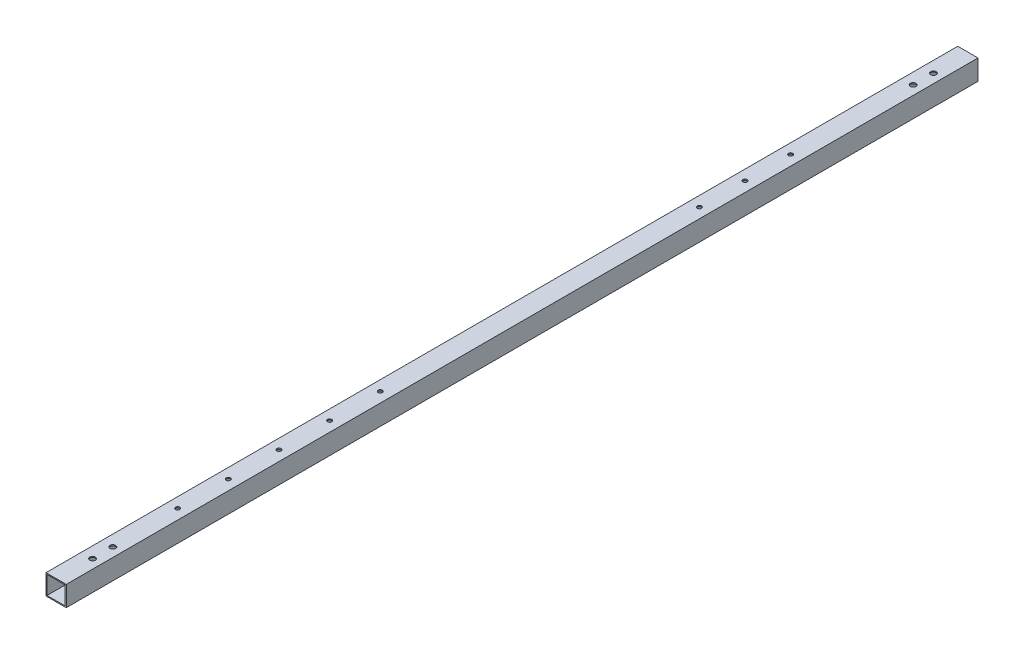
from build123d import *

# Parameters (mm, degrees)
SKETCH_1_W          = 20
SKETCH_1_H          = 20
SKETCH_1_W_2        = 18
SKETCH_1_H_2        = 18
EXTRUDE_1_DEPTH     = 900
SKETCH_2_R          = 2.75
CUT_EXTRUDE_1_DEPTH = 37
SKETCH_3_R          = 2.1
CUT_EXTRUDE_2_DEPTH = 37
SKETCH_4_R          = 2.1
CUT_EXTRUDE_3_DEPTH = 37


with BuildPart() as part:
    # 草图1 → 拉伸-薄壁1 (new body)
    with BuildSketch(Plane.XY):
        with Locations((10, -10)):
            Rectangle(SKETCH_1_W, SKETCH_1_H)
        with Locations((10, -10)):
            Rectangle(SKETCH_1_W_2, SKETCH_1_H_2, mode=Mode.SUBTRACT)
    extrude(amount=EXTRUDE_1_DEPTH)

    # 草图2 → 切除-拉伸1 (cut)
    with BuildSketch(Plane(origin=(0, 0, 0), x_dir=(1, 0, 0), z_dir=(0, 1, 0))):
        with Locations(Location((11, -35, 0), (0, 0, 270))):
            Circle(SKETCH_2_R)
        with Locations(Location((11, -55, 0), (0, 0, 270))):
            Circle(SKETCH_2_R)
        with Locations(Location((11, -845, 0), (0, 0, 90))):
            Circle(SKETCH_2_R)
        with Locations(Location((11, -865, 0), (0, 0, 90))):
            Circle(SKETCH_2_R)
    extrude(amount=-CUT_EXTRUDE_1_DEPTH, mode=Mode.SUBTRACT)

    # 草图3 → 切除-拉伸2 (cut)
    with BuildSketch(Plane(origin=(0, 0, 0), x_dir=(1, 0, 0), z_dir=(0, 1, 0))):
        with Locations(Location((10, -175, 0), (0, 0, 270))):
            Circle(SKETCH_3_R)
        with Locations(Location((10, -220, 0), (0, 0, 270))):
            Circle(SKETCH_3_R)
        with Locations(Location((10, -265, 0), (0, 0, 270))):
            Circle(SKETCH_3_R)
    extrude(amount=-CUT_EXTRUDE_2_DEPTH, mode=Mode.SUBTRACT)

    # 草图4 → 切除-拉伸3 (cut)
    with BuildSketch(Plane(origin=(0, 0, 0), x_dir=(1, 0, 0), z_dir=(0, 1, 0))):
        with Locations(Location((10, -780, 0), (0, 0, 270))):
            Circle(SKETCH_4_R)
        with Locations(Location((10, -730, 0), (0, 0, 270))):
            Circle(SKETCH_4_R)
        with Locations(Location((10, -680, 0), (0, 0, 270))):
            Circle(SKETCH_4_R)
        with Locations(Location((10, -630, 0), (0, 0, 270))):
            Circle(SKETCH_4_R)
        with Locations(Location((10, -580, 0), (0, 0, 270))):
            Circle(SKETCH_4_R)
    extrude(amount=-CUT_EXTRUDE_3_DEPTH, mode=Mode.SUBTRACT)


solid = part.part
